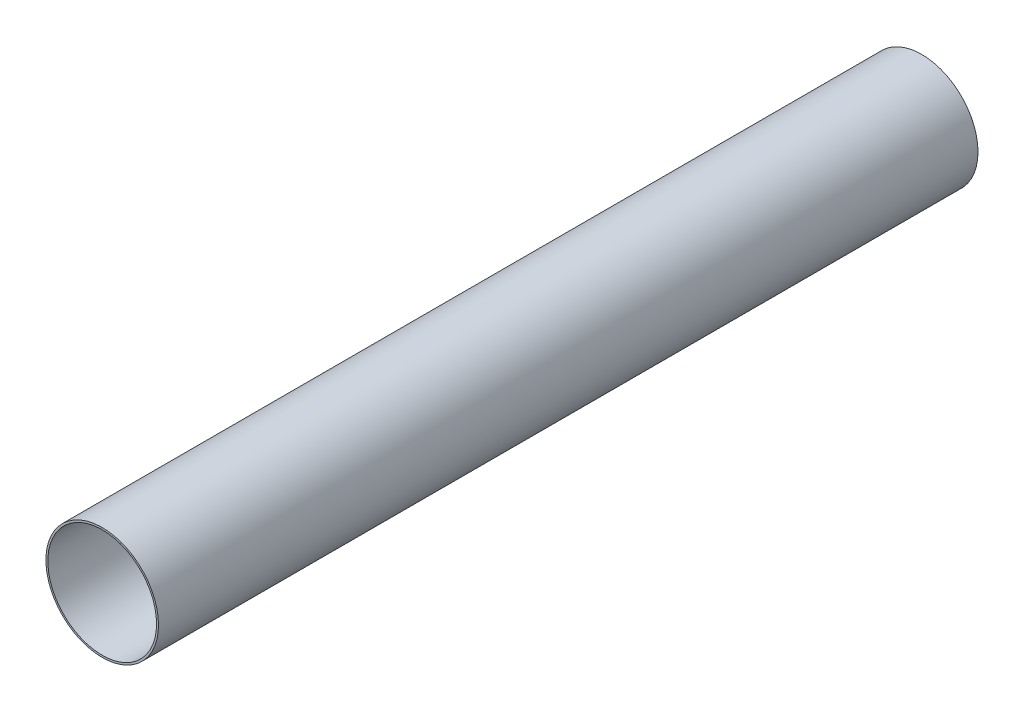
from build123d import *

# Parameters (mm, degrees)
ESQUISSE1_R        = 79
ESQUISSE1_R_2      = 76.29
BOSS_EXTRU_1_DEPTH = 1150


with BuildPart() as part:
    # Esquisse1 → Boss.-Extru.1 (new body)
    with BuildSketch(Plane.XY):
        Circle(ESQUISSE1_R)
        Circle(ESQUISSE1_R_2, mode=Mode.SUBTRACT)
    extrude(amount=BOSS_EXTRU_1_DEPTH)


solid = part.part
